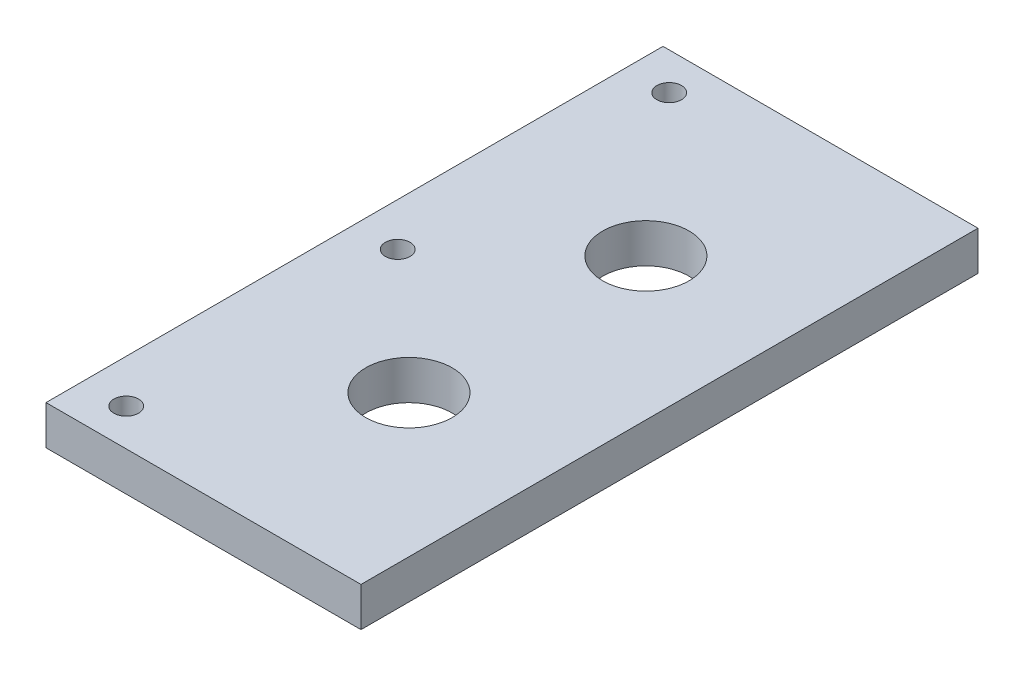
from build123d import *

# Parameters (mm, degrees)
SKETCH1_W           = 51.050535797
SKETCH1_H           = 100
SKETCH1_R           = 2
SKETCH1_R_2         = 7
BOSS_EXTRUDE1_DEPTH = 6.35


with BuildPart() as part:
    # Sketch1 → Boss-Extrude1 (new body)
    with BuildSketch(Plane(origin=(0, 0, 0), x_dir=(1, 0, 0), z_dir=(0, 1, 0))):
        with Locations((20.525267899, 50)):
            Rectangle(SKETCH1_W, SKETCH1_H)
        with Locations(Location((2, 50, 0), (0, 0, 270))):
            Circle(SKETCH1_R, mode=Mode.SUBTRACT)
        with Locations(Location((2, 94, 0), (0, 0, 270))):
            Circle(SKETCH1_R, mode=Mode.SUBTRACT)
        with Locations(Location((2, 6, 0), (0, 0, 270))):
            Circle(SKETCH1_R, mode=Mode.SUBTRACT)
        with Locations(Location((23.025267899, 30.8, 0), (0, 0, 270))):
            Circle(SKETCH1_R_2, mode=Mode.SUBTRACT)
        with Locations(Location((23.025267899, 69.2, 0), (0, 0, 270))):
            Circle(SKETCH1_R_2, mode=Mode.SUBTRACT)
    extrude(amount=BOSS_EXTRUDE1_DEPTH)


solid = part.part
